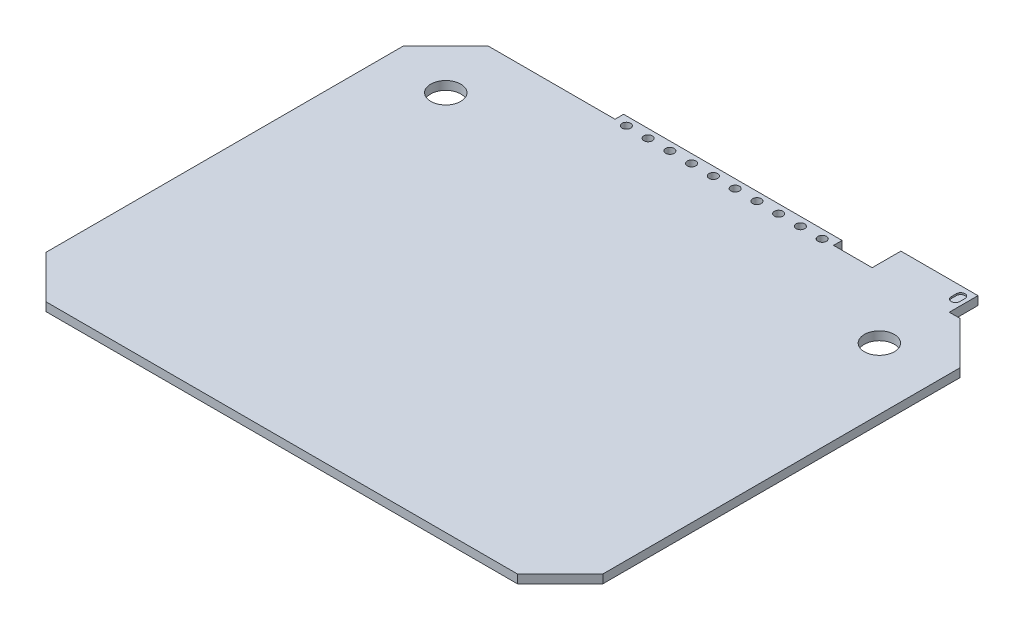
from build123d import *

# Parameters (mm, degrees)
SKETCH1_W           = 65
SKETCH1_H           = 51.65
BOSS_EXTRUDE1_DEPTH = 1
CHAMFER1_SIZE       = 5
CUT_EXTRUDE2_REACH  = 43.523
SKETCH2_R           = 1.75
SKETCH3_W           = 25.5
SKETCH3_H           = 1
BOSS_EXTRUDE3_DEPTH = 1
CUT_EXTRUDE3_REACH  = 44.152
SKETCH4_R           = 0.5
LPATTERN1_COUNT     = 6
LPATTERN1_PITCH     = 2.54
LPATTERN1_COL_COUNT = 5
LPATTERN1_COL_PITCH = 2.54
SKETCH5_W           = 9
SKETCH5_H           = 3.35
BOSS_EXTRUDE4_DEPTH = 1
CUT_EXTRUDE4_DEPTH  = 0.2


with BuildPart() as part:
    # Sketch1 → Boss-Extrude1 (new body)
    with BuildSketch(Plane(origin=(0, 0, 0), x_dir=(1, 0, 0), z_dir=(0, 1, 0))):
        Rectangle(SKETCH1_W, SKETCH1_H)
    extrude(amount=BOSS_EXTRUDE1_DEPTH)

    # Chamfer1
    chamfer1_edges = [part.edges().sort_by_distance(p)[0] for p in [
        (-32.5, 0.5, -25.825),
        (32.5, 0.5, -25.825),
        (32.5, 0.5, 25.825),
        (-32.5, 0.5, 25.825),
    ]]
    chamfer(chamfer1_edges, length=CHAMFER1_SIZE)

    # Sketch2 → Cut-Extrude2 (cut, up to next)
    with BuildSketch(Plane(origin=(0, 0, 0), x_dir=(1, 0, 0), z_dir=(0, 1, 0)), mode=Mode.PRIVATE) as cut_extrude2_sk1:
        with Locations(Location((-25.3, 18.625, 0), (0, 0, 270))):
            Circle(SKETCH2_R)
    cut_extrude2_tool1 = extrude(cut_extrude2_sk1.sketch, amount=CUT_EXTRUDE2_REACH, mode=Mode.PRIVATE) & part.part
    # Sketch2 → Cut-Extrude2 (cut, up to next)
    with BuildSketch(Plane(origin=(0, 0, 0), x_dir=(1, 0, 0), z_dir=(0, 1, 0)), mode=Mode.PRIVATE) as cut_extrude2_sk2:
        with Locations(Location((25.3, 18.625, 0), (0, 0, 270))):
            Circle(SKETCH2_R)
    cut_extrude2_tool2 = extrude(cut_extrude2_sk2.sketch, amount=CUT_EXTRUDE2_REACH, mode=Mode.PRIVATE) & part.part
    add(cut_extrude2_tool1.solids().sort_by_distance((-25.3, 0, -18.625))[0], mode=Mode.SUBTRACT)
    add(cut_extrude2_tool2.solids().sort_by_distance((25.3, 0, -18.625))[0], mode=Mode.SUBTRACT)

    # Sketch3 → Boss-Extrude3 (add)
    with BuildSketch(Plane(origin=(0, 1, 0), x_dir=(1, 0, 0), z_dir=(0, 1, 0))):
        with Locations((0, 26.325)):
            Rectangle(SKETCH3_W, SKETCH3_H)
    extrude(amount=-BOSS_EXTRUDE3_DEPTH)

    # Sketch4 → Cut-Extrude3 (cut, up to next)
    with BuildSketch(Plane(origin=(0, 1, 0), x_dir=(1, 0, 0), z_dir=(0, 1, 0)), mode=Mode.PRIVATE) as cut_extrude3_sk1:
        with Locations(Location((-1.27, 25.825, 0), (0, 0, 270))):
            Circle(SKETCH4_R)
    cut_extrude3_tool1 = extrude(cut_extrude3_sk1.sketch, amount=-CUT_EXTRUDE3_REACH, mode=Mode.PRIVATE) & part.part
    cut_extrude3 = cut_extrude3_tool1.solids().sort_by_distance((-1.27, 1, -25.825))[0]
    add(cut_extrude3, mode=Mode.SUBTRACT)

    # LPattern1: Cut-Extrude3 ×6
    with Locations(*[(i * LPATTERN1_PITCH, 0, 0) for i in range(1, LPATTERN1_COUNT)]):
        add(cut_extrude3, mode=Mode.SUBTRACT)

    # LPattern1 col: Cut-Extrude3 ×5
    with Locations(*[(-i * LPATTERN1_COL_PITCH, 0, 0) for i in range(1, LPATTERN1_COL_COUNT)]):
        add(cut_extrude3, mode=Mode.SUBTRACT)

    # Sketch5 → Boss-Extrude4 (add)
    with BuildSketch(Plane(origin=(0, 1, 0), x_dir=(1, 0, 0), z_dir=(0, 1, 0))):
        with Locations((21.76, 27.5)):
            Rectangle(SKETCH5_W, SKETCH5_H)
    extrude(amount=-BOSS_EXTRUDE4_DEPTH)

    # Sketch6 → Cut-Extrude4 (cut)
    with BuildSketch(Plane(origin=(0, 1, 0), x_dir=(1, 0, 0), z_dir=(0, 1, 0))):
        with BuildLine():
            Line((25.8, 28.115), (25.8, 27.515))
            ThreePointArc((25.8, 27.515), (25.3, 27.015), (24.8, 27.515))
            Line((24.8, 27.515), (24.8, 28.115))
            ThreePointArc((24.8, 28.115), (25.3, 28.615), (25.8, 28.115))
        make_face()
    extrude(amount=-CUT_EXTRUDE4_DEPTH, mode=Mode.SUBTRACT)


solid = part.part
